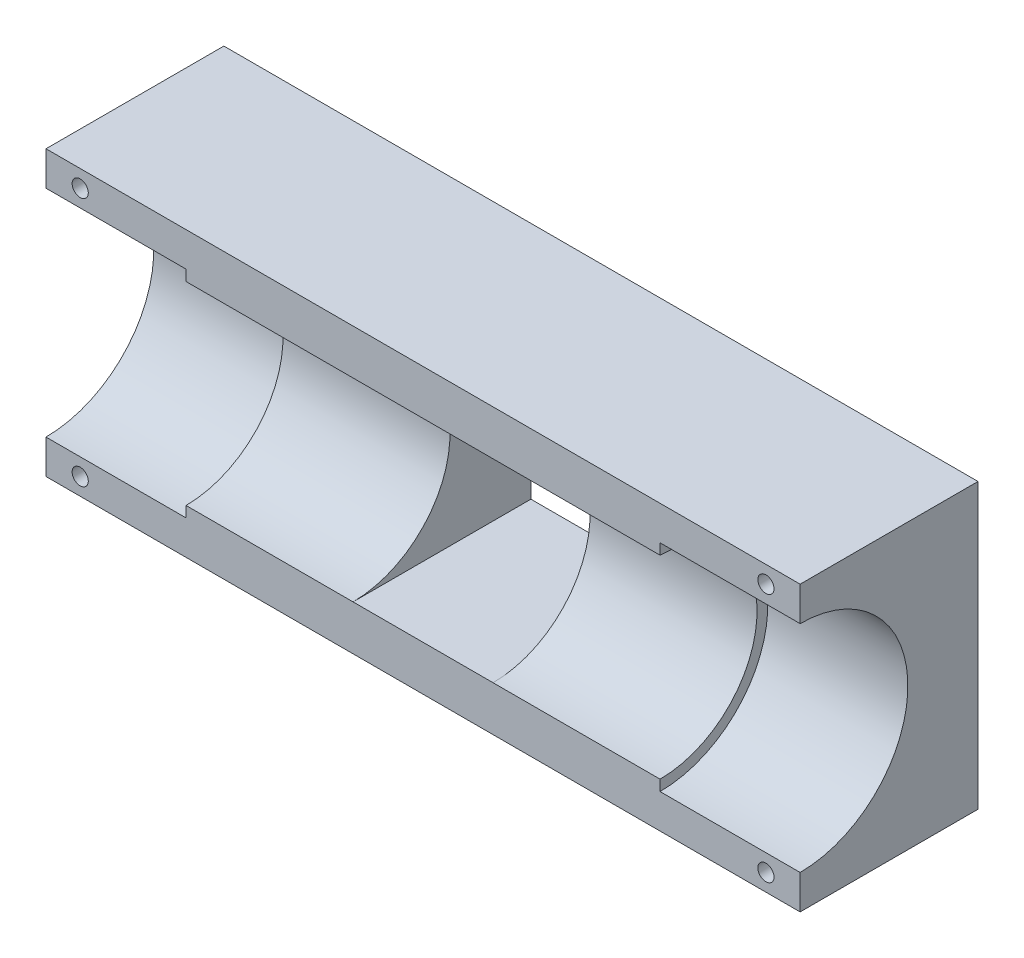
from build123d import *

# Parameters (mm, degrees)
SKETCH1_W               = 139.999999908
SKETCH1_H               = 52.6999962
BOSS_EXTRUDE1_DEPTH     = 33.02
CUT_EXTRUDE1_DEPTH      = 154.191416123
CUT_EXTRUDE1_DEPTH_BACK = 154.191416123
CUT_EXTRUDE2_DEPTH      = 26
CUT_EXTRUDE3_START      = -26
CUT_EXTRUDE3_DEPTH      = 26
CUT_EXTRUDE4_DEPTH      = 154.191416123
CUT_EXTRUDE4_DEPTH_BACK = 154.191416123
SKETCH6_W               = 26
SKETCH6_H               = 36
CUT_EXTRUDE5_DEPTH      = 154.191416123
CUT_EXTRUDE5_DEPTH_BACK = 154.191416123
SKETCH7_R               = 1.500000048
SKETCH7_R_2             = 1.5


with BuildPart() as part:
    # Sketch1 → Boss-Extrude1 (new body)
    with BuildSketch(Plane.XY):
        with Locations((69.999999954, 26.3499981)):
            Rectangle(SKETCH1_W, SKETCH1_H)
    extrude(amount=BOSS_EXTRUDE1_DEPTH)

    # Sketch2 → Cut-Extrude1 (cut, two sides: drawn at the far end of the back side and taken through both)
    with BuildSketch(Plane.ZY.offset(-CUT_EXTRUDE1_DEPTH_BACK)):
        with BuildLine():
            Line((33.02, 44.3499981), (33.02, 8.3499981))
            ThreePointArc((33.02, 8.3499981), (15.02, 26.3499981), (33.02, 44.3499981))
        make_face()
    extrude(amount=CUT_EXTRUDE1_DEPTH + CUT_EXTRUDE1_DEPTH_BACK, mode=Mode.SUBTRACT)

    # Sketch3 → Cut-Extrude2 (cut)
    with BuildSketch(Plane.ZY):
        with BuildLine():
            Line((33.02, 46.3499981), (33.02, 6.3499981))
            ThreePointArc((33.02, 6.3499981), (13.02, 26.3499981), (33.02, 46.3499981))
        make_face()
    extrude(amount=-CUT_EXTRUDE2_DEPTH, mode=Mode.SUBTRACT)

    # Sketch5 → Cut-Extrude3 (cut)
    with BuildSketch(Plane(origin=(139.999999908, 0, 0), x_dir=(0, 0, -1), z_dir=(1, 0, 0)).offset(CUT_EXTRUDE3_START)):
        with BuildLine():
            Line((-33.02, 46.3499981), (-33.02, 6.3499981))
            ThreePointArc((-33.02, 6.3499981), (-13.02, 26.3499981), (-33.02, 46.3499981))
        make_face()
    extrude(amount=CUT_EXTRUDE3_DEPTH, mode=Mode.SUBTRACT)

    # Sketch6 → Cut-Extrude4 (cut, two sides: drawn at the far end of the back side and taken through both)
    with BuildSketch(Plane(origin=(0, 0, 0), x_dir=(-1, 0, 0), z_dir=(0, 0, -1)).offset(-CUT_EXTRUDE4_DEPTH_BACK)):
        with Locations((-69.999999954, 26.3499981)):
            Rectangle(SKETCH6_W, SKETCH6_H)
    extrude(amount=CUT_EXTRUDE4_DEPTH + CUT_EXTRUDE4_DEPTH_BACK, mode=Mode.SUBTRACT)

    # Sketch7 → Cut-Extrude5 (cut, two sides: drawn at the far end of the back side and taken through both)
    with BuildSketch(Plane.XY.offset(33.02).offset(-CUT_EXTRUDE5_DEPTH_BACK)):
        with Locations((6.35, 49.52499715)):
            Circle(SKETCH7_R)
        with Locations((6.35, 3.17499905)):
            Circle(SKETCH7_R_2)
        with Locations((133.649999908, 49.52499715)):
            Circle(SKETCH7_R_2)
        with Locations((133.649999908, 3.17499905)):
            Circle(SKETCH7_R_2)
    extrude(amount=CUT_EXTRUDE5_DEPTH + CUT_EXTRUDE5_DEPTH_BACK, mode=Mode.SUBTRACT)


solid = part.part
